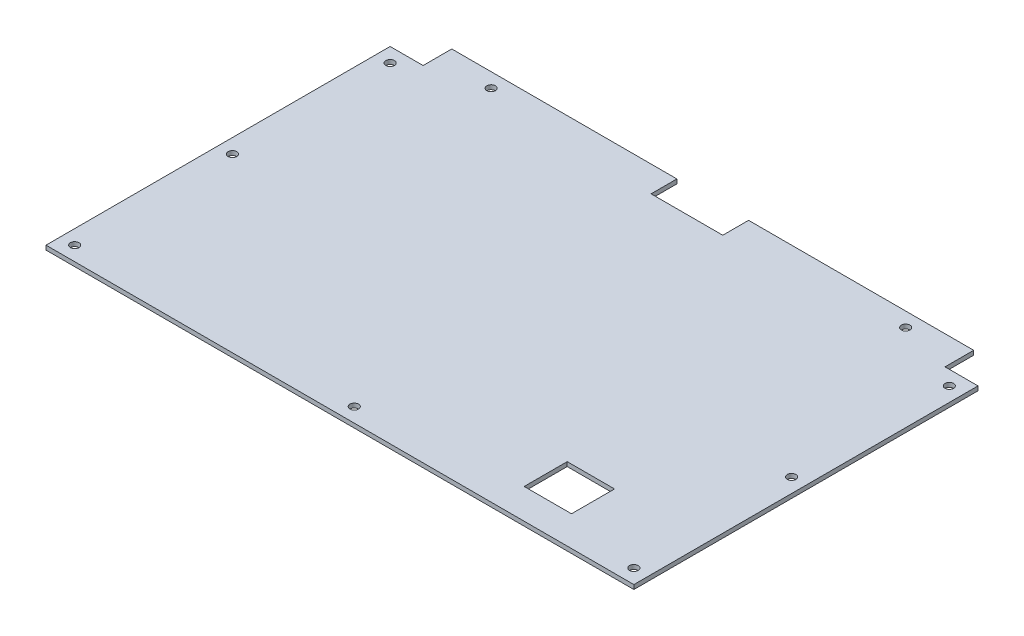
from build123d import *

# Parameters (mm, degrees)
CROQUIS1_R              = 3
SALIENTE_EXTRUIR1_DEPTH = 3
CROQUIS2_W              = 33
CROQUIS2_H              = 30
CORTAR_EXTRUIR2_DEPTH   = 3


with BuildPart() as part:
    # Croquis1 → Saliente-Extruir1 (new body)
    with BuildSketch(Plane(origin=(0, 0, 0), x_dir=(1, 0, 0), z_dir=(0, 1, 0))):
        Polygon((182, 120), (205, 120), (205, -120), (-205, -120), (-205, 120), (-182, 120), (-182, 140), (-25, 140), (-25, 122), (25, 122), (25, 140), (182, 140), align=None)
        with Locations(Location((-195, 110, 0), (0, 0, 270))):
            Circle(CROQUIS1_R, mode=Mode.SUBTRACT)
        with Locations(Location((-195, 0, 0), (0, 0, 270))):
            Circle(CROQUIS1_R, mode=Mode.SUBTRACT)
        with Locations(Location((-195, -110, 0), (0, 0, 90))):
            Circle(CROQUIS1_R, mode=Mode.SUBTRACT)
        with Locations(Location((195, -110, 0), (0, 0, 270))):
            Circle(CROQUIS1_R, mode=Mode.SUBTRACT)
        with Locations(Location((195, 0, 0), (0, 0, 90))):
            Circle(CROQUIS1_R, mode=Mode.SUBTRACT)
        with Locations(Location((195, 110, 0), (0, 0, 90))):
            Circle(CROQUIS1_R, mode=Mode.SUBTRACT)
        with Locations(Location((0, -110, 0), (0, 0, 270))):
            Circle(CROQUIS1_R, mode=Mode.SUBTRACT)
        with Locations(Location((144.549746064, 130, 0), (0, 0, 270))):
            Circle(CROQUIS1_R, mode=Mode.SUBTRACT)
        with Locations(Location((-144.549746064, 130, 0), (0, 0, 90))):
            Circle(CROQUIS1_R, mode=Mode.SUBTRACT)
    extrude(amount=SALIENTE_EXTRUIR1_DEPTH)

    # Croquis2 → Cortar-Extruir2 (cut)
    with BuildSketch(Plane(origin=(0, 3, 0), x_dir=(1, 0, 0), z_dir=(0, 1, 0))):
        with Locations((123.996419689, -84)):
            Rectangle(CROQUIS2_W, CROQUIS2_H)
    extrude(amount=-CORTAR_EXTRUIR2_DEPTH, mode=Mode.SUBTRACT)


solid = part.part
